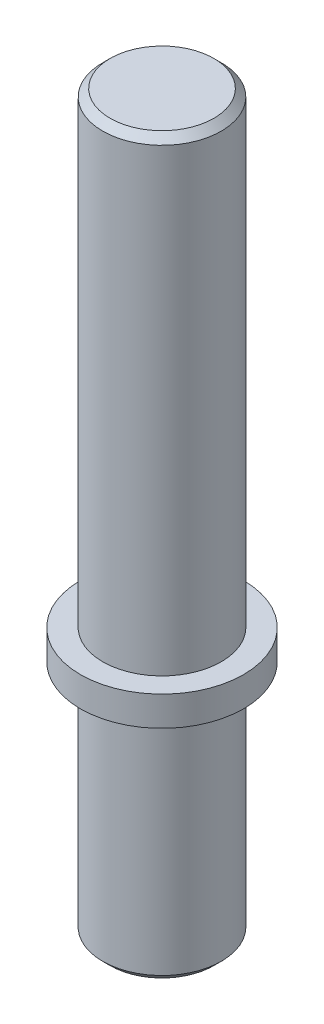
from build123d import *

# Parameters (mm, degrees)
SKETCH1_R           = 4
BOSS_EXTRUDE1_DEPTH = 16
SKETCH2_R           = 5.5
BOSS_EXTRUDE2_DEPTH = 2
SKETCH3_R           = 4
BOSS_EXTRUDE3_DEPTH = 31.5
CHAMFER1_SIZE       = 0.5


with BuildPart() as part:
    # Sketch1 → Boss-Extrude1 (new body)
    with BuildSketch(Plane(origin=(0, 0, 0), x_dir=(1, 0, 0), z_dir=(0, 1, 0))):
        with Locations(Location((0, 0, 0), (0, 0, 270))):
            Circle(SKETCH1_R)
    extrude(amount=BOSS_EXTRUDE1_DEPTH)

    # Sketch2 → Boss-Extrude2 (add)
    with BuildSketch(Plane(origin=(0, 16, 0), x_dir=(1, 0, 0), z_dir=(0, 1, 0))):
        with Locations(Location((0, 0, 0), (0, 0, 270))):
            Circle(SKETCH2_R)
    extrude(amount=BOSS_EXTRUDE2_DEPTH)

    # Sketch3 → Boss-Extrude3 (add)
    with BuildSketch(Plane(origin=(0, 18, 0), x_dir=(1, 0, 0), z_dir=(0, 1, 0))):
        with Locations(Location((0, 0, 0), (0, 0, 270))):
            Circle(SKETCH3_R)
    extrude(amount=BOSS_EXTRUDE3_DEPTH)

    # Chamfer1
    chamfer1_edges = [part.edges().sort_by_distance(p)[0] for p in [
        (0, 49.5, -4),
        (0, 0, -4),
    ]]
    chamfer(chamfer1_edges, length=CHAMFER1_SIZE)


solid = part.part
